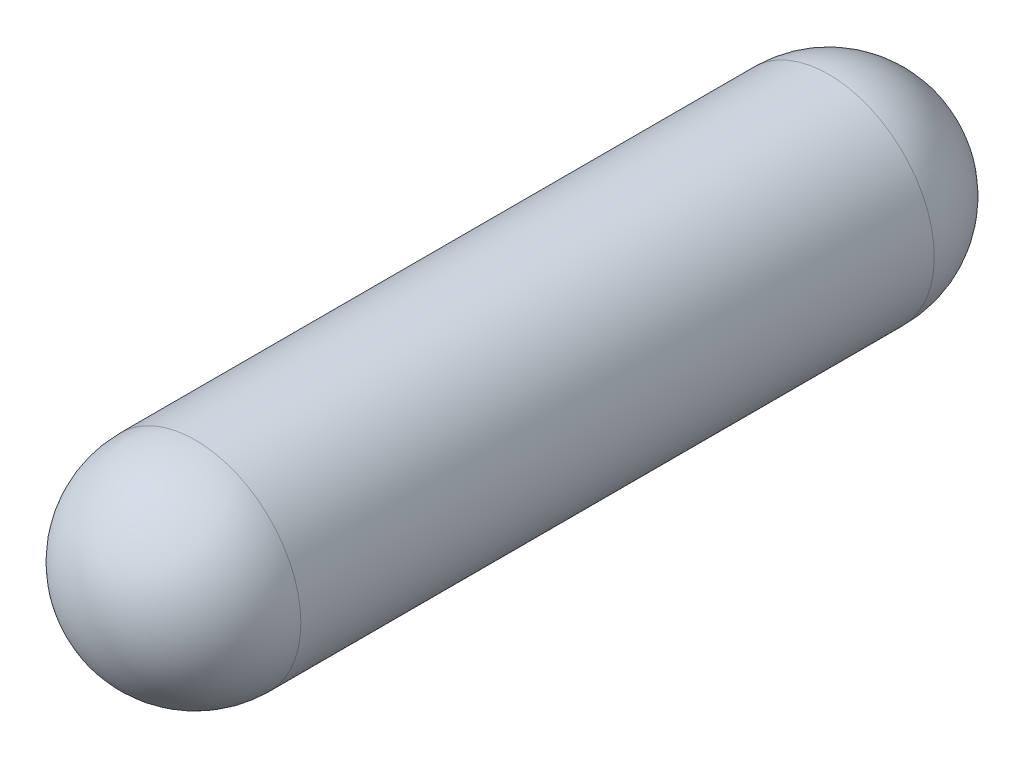
from build123d import *

# Parameters (mm, degrees)
SKETCH1_R           = 1
BOSS_EXTRUDE1_DEPTH = 8
FILLET1_R           = 1


with BuildPart() as part:
    # Sketch1 → Boss-Extrude1 (new body)
    with BuildSketch(Plane.XY):
        Circle(SKETCH1_R)
    extrude(amount=BOSS_EXTRUDE1_DEPTH)

    # Fillet1
    fillet1_edges = [part.edges().sort_by_distance(p)[0] for p in [
        (-1, 0, 0),
        (-1, 0, 8),
    ]]
    fillet(fillet1_edges, radius=FILLET1_R)


solid = part.part
